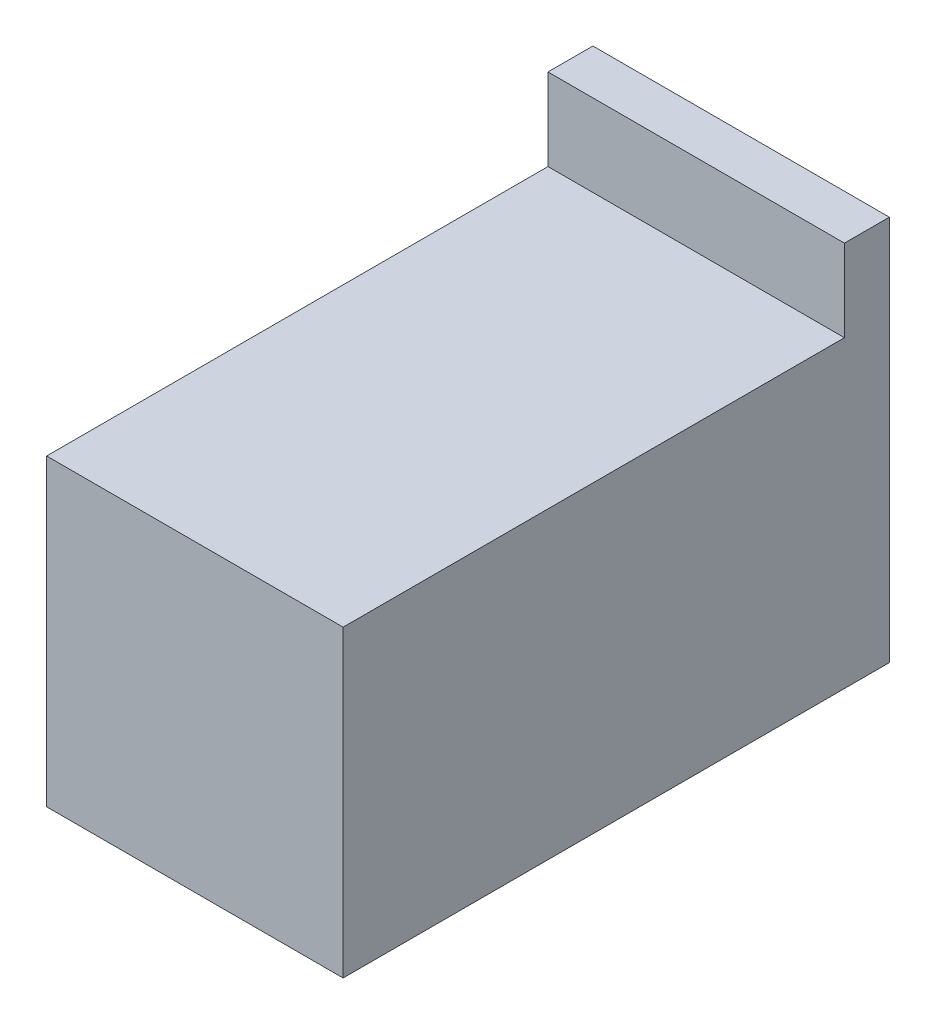
from build123d import *

# Parameters (mm, degrees)
SKETCH_1_W      = 43.42
SKETCH_1_H      = 44.5
EXTRUDE_1_DEPTH = 80
SKETCH_3_W      = 43.42
SKETCH_3_H      = 6.58
EXTRUDE_2_DEPTH = 12


with BuildPart() as part:
    # 草图1 → 凸台-拉伸1 (new body)
    with BuildSketch(Plane.XY):
        Rectangle(SKETCH_1_W, SKETCH_1_H)
    extrude(amount=EXTRUDE_1_DEPTH)

    # 草图3 → 凸台-拉伸2 (add)
    with BuildSketch(Plane(origin=(0, 22.25, 0), x_dir=(1, 0, 0), z_dir=(0, 1, 0))):
        with Locations((0, -3.29)):
            Rectangle(SKETCH_3_W, SKETCH_3_H)
    extrude(amount=EXTRUDE_2_DEPTH)


solid = part.part
